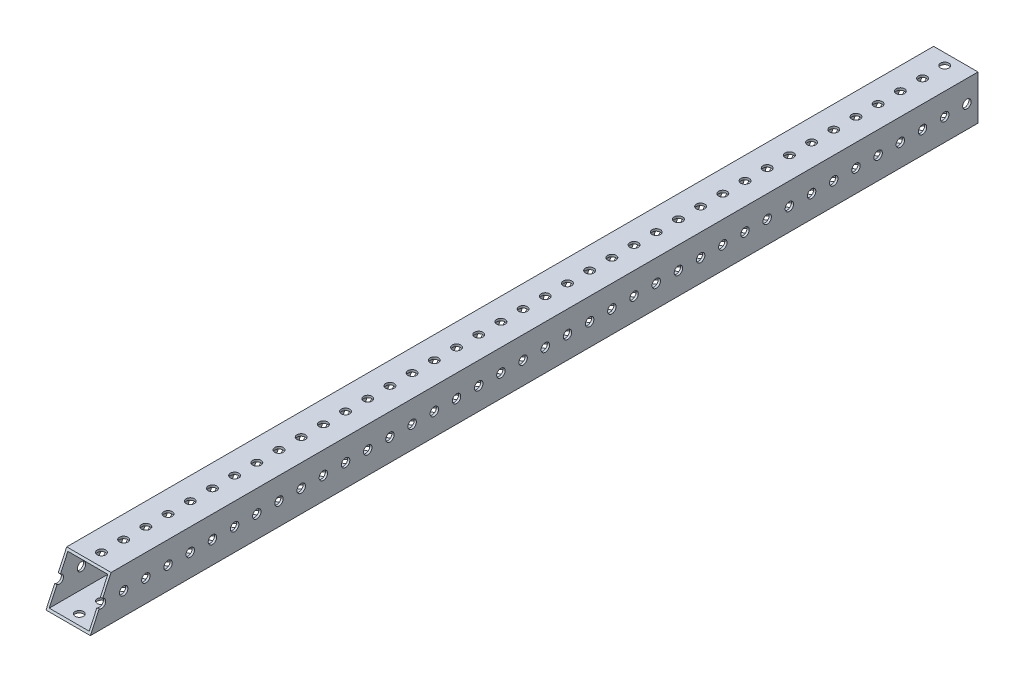
from build123d import *

# Parameters (mm, degrees)
SKETCH1_W           = 25.4
SKETCH1_H           = 508
BOSS_EXTRUDE1_DEPTH = 25.4
SKETCH2_W           = 22.86
SKETCH2_H           = 22.86
CUT_EXTRUDE1_DEPTH  = 510.268416456
SKETCH3_R           = 2.413
CUT_EXTRUDE2_DEPTH  = 510.268416456
SKETCH4_R           = 2.413
CUT_EXTRUDE3_DEPTH  = 510.268416456
CUT_EXTRUDE4_DEPTH  = 510.268416456


with BuildPart() as part:
    # Sketch1 → Boss-Extrude1 (new body)
    with BuildSketch(Plane(origin=(0, 0, 0), x_dir=(1, 0, 0), z_dir=(0, 1, 0))):
        with Locations((12.7, 254)):
            Rectangle(SKETCH1_W, SKETCH1_H)
    extrude(amount=BOSS_EXTRUDE1_DEPTH)

    # Sketch2 → Cut-Extrude1 (cut, through all)
    with BuildSketch(Plane.XY):
        with Locations((12.7, 12.7)):
            Rectangle(SKETCH2_W, SKETCH2_H)
    extrude(amount=-CUT_EXTRUDE1_DEPTH, mode=Mode.SUBTRACT)

    # Sketch3 → Cut-Extrude2 (cut, through all)
    with BuildSketch(Plane(origin=(0, 25.4, 0), x_dir=(1, 0, 0), z_dir=(0, 1, 0))):
        with Locations(Location((12.7, 6.35, 0), (0, 0, 270))):
            Circle(SKETCH3_R)
        with Locations(Location((12.7, 19.05, 0), (0, 0, 270))):
            Circle(SKETCH3_R)
        with Locations(Location((12.7, 31.75, 0), (0, 0, 270))):
            Circle(SKETCH3_R)
        with Locations(Location((12.7, 44.45, 0), (0, 0, 270))):
            Circle(SKETCH3_R)
        with Locations(Location((12.7, 57.15, 0), (0, 0, 270))):
            Circle(SKETCH3_R)
        with Locations(Location((12.7, 69.85, 0), (0, 0, 270))):
            Circle(SKETCH3_R)
        with Locations(Location((12.7, 82.55, 0), (0, 0, 270))):
            Circle(SKETCH3_R)
        with Locations(Location((12.7, 95.25, 0), (0, 0, 270))):
            Circle(SKETCH3_R)
        with Locations(Location((12.7, 107.95, 0), (0, 0, 270))):
            Circle(SKETCH3_R)
        with Locations(Location((12.7, 120.65, 0), (0, 0, 270))):
            Circle(SKETCH3_R)
        with Locations(Location((12.7, 133.35, 0), (0, 0, 270))):
            Circle(SKETCH3_R)
        with Locations(Location((12.7, 146.05, 0), (0, 0, 270))):
            Circle(SKETCH3_R)
        with Locations(Location((12.7, 158.75, 0), (0, 0, 270))):
            Circle(SKETCH3_R)
        with Locations(Location((12.7, 171.45, 0), (0, 0, 270))):
            Circle(SKETCH3_R)
        with Locations(Location((12.7, 184.15, 0), (0, 0, 270))):
            Circle(SKETCH3_R)
        with Locations(Location((12.7, 196.85, 0), (0, 0, 270))):
            Circle(SKETCH3_R)
        with Locations(Location((12.7, 209.55, 0), (0, 0, 270))):
            Circle(SKETCH3_R)
        with Locations(Location((12.7, 222.25, 0), (0, 0, 270))):
            Circle(SKETCH3_R)
        with Locations(Location((12.7, 234.95, 0), (0, 0, 270))):
            Circle(SKETCH3_R)
        with Locations(Location((12.7, 247.65, 0), (0, 0, 270))):
            Circle(SKETCH3_R)
        with Locations(Location((12.7, 260.35, 0), (0, 0, 270))):
            Circle(SKETCH3_R)
        with Locations(Location((12.7, 273.05, 0), (0, 0, 270))):
            Circle(SKETCH3_R)
        with Locations(Location((12.7, 285.75, 0), (0, 0, 270))):
            Circle(SKETCH3_R)
        with Locations(Location((12.7, 298.45, 0), (0, 0, 270))):
            Circle(SKETCH3_R)
        with Locations(Location((12.7, 311.15, 0), (0, 0, 270))):
            Circle(SKETCH3_R)
        with Locations(Location((12.7, 323.85, 0), (0, 0, 270))):
            Circle(SKETCH3_R)
        with Locations(Location((12.7, 336.55, 0), (0, 0, 270))):
            Circle(SKETCH3_R)
        with Locations(Location((12.7, 349.25, 0), (0, 0, 270))):
            Circle(SKETCH3_R)
        with Locations(Location((12.7, 361.95, 0), (0, 0, 270))):
            Circle(SKETCH3_R)
        with Locations(Location((12.7, 374.65, 0), (0, 0, 270))):
            Circle(SKETCH3_R)
        with Locations(Location((12.7, 387.35, 0), (0, 0, 270))):
            Circle(SKETCH3_R)
        with Locations(Location((12.7, 400.05, 0), (0, 0, 270))):
            Circle(SKETCH3_R)
        with Locations(Location((12.7, 412.75, 0), (0, 0, 270))):
            Circle(SKETCH3_R)
        with Locations(Location((12.7, 425.45, 0), (0, 0, 270))):
            Circle(SKETCH3_R)
        with Locations(Location((12.7, 438.15, 0), (0, 0, 270))):
            Circle(SKETCH3_R)
        with Locations(Location((12.7, 450.85, 0), (0, 0, 270))):
            Circle(SKETCH3_R)
        with Locations(Location((12.7, 463.55, 0), (0, 0, 270))):
            Circle(SKETCH3_R)
        with Locations(Location((12.7, 476.25, 0), (0, 0, 270))):
            Circle(SKETCH3_R)
        with Locations(Location((12.7, 488.95, 0), (0, 0, 270))):
            Circle(SKETCH3_R)
        with Locations(Location((12.7, 501.65, 0), (0, 0, 270))):
            Circle(SKETCH3_R)
        with Locations((12.7, 514.35)):
            Circle(SKETCH3_R)
        with Locations((12.7, 527.05)):
            Circle(SKETCH3_R)
        with Locations((12.7, 539.75)):
            Circle(SKETCH3_R)
        with Locations((12.7, 552.45)):
            Circle(SKETCH3_R)
    extrude(amount=-CUT_EXTRUDE2_DEPTH, mode=Mode.SUBTRACT)

    # Sketch4 → Cut-Extrude3 (cut, through all)
    with BuildSketch(Plane.ZY):
        with Locations((-6.35, 12.7)):
            Circle(SKETCH4_R)
        with Locations((-19.05, 12.7)):
            Circle(SKETCH4_R)
        with Locations((-31.75, 12.7)):
            Circle(SKETCH4_R)
        with Locations((-44.45, 12.7)):
            Circle(SKETCH4_R)
        with Locations((-57.15, 12.7)):
            Circle(SKETCH4_R)
        with Locations((-69.85, 12.7)):
            Circle(SKETCH4_R)
        with Locations((-82.55, 12.7)):
            Circle(SKETCH4_R)
        with Locations((-95.25, 12.7)):
            Circle(SKETCH4_R)
        with Locations((-107.95, 12.7)):
            Circle(SKETCH4_R)
        with Locations((-120.65, 12.7)):
            Circle(SKETCH4_R)
        with Locations((-133.35, 12.7)):
            Circle(SKETCH4_R)
        with Locations((-146.05, 12.7)):
            Circle(SKETCH4_R)
        with Locations((-158.75, 12.7)):
            Circle(SKETCH4_R)
        with Locations((-171.45, 12.7)):
            Circle(SKETCH4_R)
        with Locations((-184.15, 12.7)):
            Circle(SKETCH4_R)
        with Locations((-196.85, 12.7)):
            Circle(SKETCH4_R)
        with Locations((-209.55, 12.7)):
            Circle(SKETCH4_R)
        with Locations((-222.25, 12.7)):
            Circle(SKETCH4_R)
        with Locations((-234.95, 12.7)):
            Circle(SKETCH4_R)
        with Locations((-247.65, 12.7)):
            Circle(SKETCH4_R)
        with Locations((-260.35, 12.7)):
            Circle(SKETCH4_R)
        with Locations((-273.05, 12.7)):
            Circle(SKETCH4_R)
        with Locations((-285.75, 12.7)):
            Circle(SKETCH4_R)
        with Locations((-298.45, 12.7)):
            Circle(SKETCH4_R)
        with Locations((-311.15, 12.7)):
            Circle(SKETCH4_R)
        with Locations((-323.85, 12.7)):
            Circle(SKETCH4_R)
        with Locations((-336.55, 12.7)):
            Circle(SKETCH4_R)
        with Locations((-349.25, 12.7)):
            Circle(SKETCH4_R)
        with Locations((-361.95, 12.7)):
            Circle(SKETCH4_R)
        with Locations((-374.65, 12.7)):
            Circle(SKETCH4_R)
        with Locations((-387.35, 12.7)):
            Circle(SKETCH4_R)
        with Locations((-400.05, 12.7)):
            Circle(SKETCH4_R)
        with Locations((-412.75, 12.7)):
            Circle(SKETCH4_R)
        with Locations((-425.45, 12.7)):
            Circle(SKETCH4_R)
        with Locations((-438.15, 12.7)):
            Circle(SKETCH4_R)
        with Locations((-450.85, 12.7)):
            Circle(SKETCH4_R)
        with Locations((-463.55, 12.7)):
            Circle(SKETCH4_R)
        with Locations((-476.25, 12.7)):
            Circle(SKETCH4_R)
        with Locations((-488.95, 12.7)):
            Circle(SKETCH4_R)
        with Locations((-501.65, 12.7)):
            Circle(SKETCH4_R)
        with Locations((-514.35, 12.7)):
            Circle(SKETCH4_R)
        with Locations((-527.05, 12.7)):
            Circle(SKETCH4_R)
        with Locations((-539.75, 12.7)):
            Circle(SKETCH4_R)
        with Locations((-552.45, 12.7)):
            Circle(SKETCH4_R)
    extrude(amount=-CUT_EXTRUDE3_DEPTH, mode=Mode.SUBTRACT)

    # Sketch6 → Cut-Extrude4 (cut, through all)
    with BuildSketch(Plane(origin=(25.4, 0, 0), x_dir=(0, 0, -1), z_dir=(1, 0, 0))):
        Polygon((0, 0), (11.844214517, 25.4), (0, 25.4), align=None)
    extrude(amount=-CUT_EXTRUDE4_DEPTH, mode=Mode.SUBTRACT)


solid = part.part
